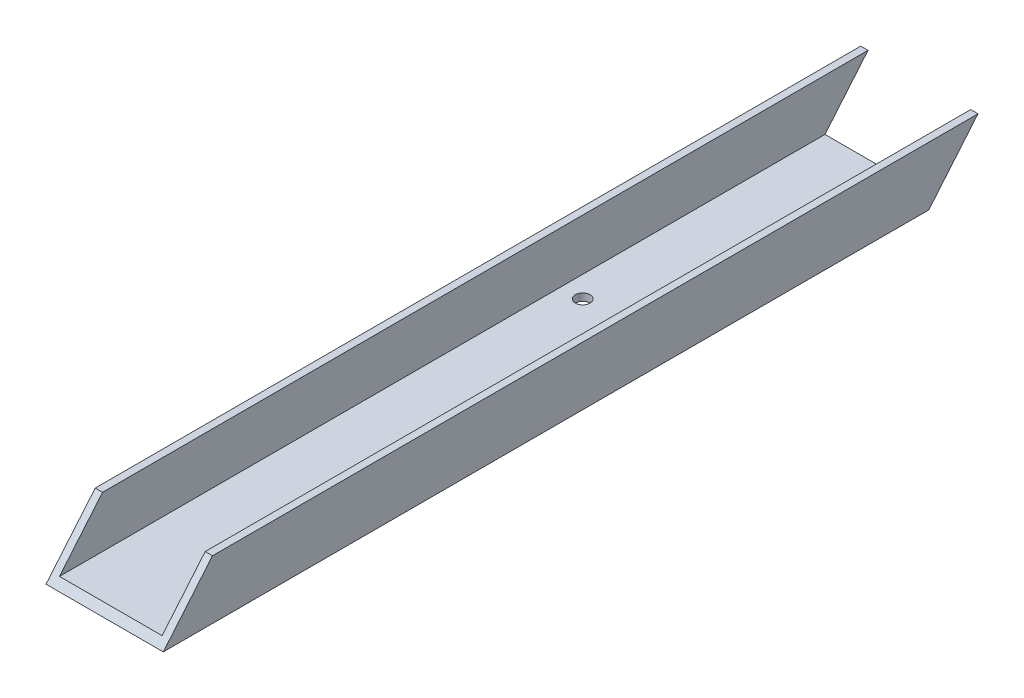
from build123d import *

# Parameters (mm, degrees)
BOSS_EXTRUDE1_DEPTH = 457.2
CUT_EXTRUDE1_REACH  = 462.55
SKETCH2_R           = 3.175
CUT_EXTRUDE2_DEPTH  = 461.714271539
CUT_EXTRUDE3_DEPTH  = 461.714271539


with BuildPart() as part:
    # Sketch1 → Boss-Extrude1 (new body)
    with BuildSketch(Plane.XY):
        Polygon((3.175, 3.175), (3.175, 25.4), (0, 25.4), (0, 0), (50.8, 0), (50.8, 25.4), (47.625, 25.4), (47.625, 3.175), align=None)
    extrude(amount=BOSS_EXTRUDE1_DEPTH)

    # Sketch2 → Cut-Extrude1 (cut, up to next)
    with BuildSketch(Plane(origin=(0, 3.175, 0), x_dir=(1, 0, 0), z_dir=(0, 1, 0)), mode=Mode.PRIVATE) as cut_extrude1_sk1:
        with Locations(Location((12.384908578, -132.81875466, 0), (0, 0, 270))):
            Circle(SKETCH2_R)
    cut_extrude1_tool1 = extrude(cut_extrude1_sk1.sketch, amount=-CUT_EXTRUDE1_REACH, mode=Mode.PRIVATE) & part.part
    add(cut_extrude1_tool1.solids().sort_by_distance((12.384909, 3.175, 132.818755))[0], mode=Mode.SUBTRACT)

    # Sketch3 → Cut-Extrude2 (cut, through all)
    with BuildSketch(Plane.ZY):
        Polygon((0, 25.4), (21.313130632, 0), (0, 0), align=None)
    extrude(amount=-CUT_EXTRUDE2_DEPTH, mode=Mode.SUBTRACT)

    # Sketch4 → Cut-Extrude3 (cut, through all)
    with BuildSketch(Plane(origin=(50.8, 0, 0), x_dir=(0, 0, -1), z_dir=(1, 0, 0))):
        Polygon((-352.886582122, 0), (-331.57345149, 25.4), (-457.2, 25.4), (-457.2, 0), align=None)
    extrude(amount=-CUT_EXTRUDE3_DEPTH, mode=Mode.SUBTRACT)


solid = part.part
